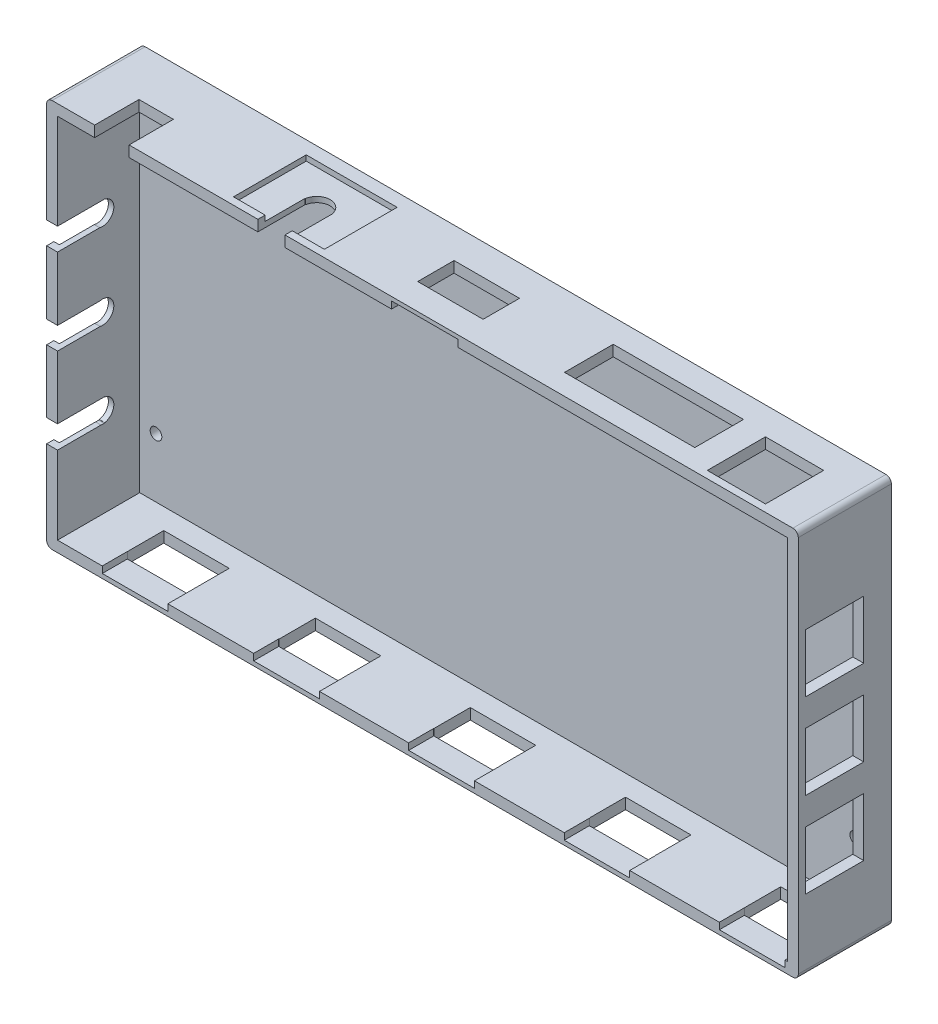
from build123d import *

# Parameters (mm, degrees)
SKETCH_1_W           = 206.744673609
SKETCH_1_H           = 106.97480061
EXTRUDE_1_DEPTH      = 3
SKETCH_3_W           = 200.744673609
SKETCH_3_H           = 100.97480061
EXTRUDE_2_DEPTH      = 22.6000508
SKETCH_4_W           = 18
SKETCH_4_H           = 10
CUT_EXTRUDE_1_DEPTH  = 5
SKETCH_6_W           = 16
SKETCH_6_H           = 16
CUT_EXTRUDE_2_DEPTH  = 5
SKETCH_7_W           = 16
SKETCH_7_H           = 16
CUT_EXTRUDE_3_DEPTH  = 5
SKETCH_8_W           = 18
SKETCH_8_H           = 10
CUT_EXTRUDE_4_DEPTH  = 5
SKETCH_9_W           = 35.828584262
SKETCH_9_H           = 13.394073463
CUT_EXTRUDE_5_DEPTH  = 5
SKETCH_10_R          = 3.719289999
CUT_EXTRUDE_6_DEPTH  = 5
SKETCH_11_W          = 9.469470229
SKETCH_11_H          = 12.194282659
CUT_EXTRUDE_7_DEPTH  = 5
SKETCH_12_R          = 3.134321658
CUT_EXTRUDE_8_DEPTH  = 5
SKETCH_13_R          = 1.6
CUT_EXTRUDE_9_DEPTH  = 5
SKETCH_15_W          = 25
SKETCH_15_H          = 20
CUT_EXTRUDE_11_DEPTH = 1.5
SKETCH_16_W          = 20
SKETCH_16_H          = 70
CUT_EXTRUDE_12_DEPTH = 1.5
FILLET_1_R           = 1.5
SKETCH_17_W          = 18.030255685
SKETCH_17_H          = 1.793339536
SKETCH_17_W_2        = 18.10659189
SKETCH_17_W_3        = 18.089855477
SKETCH_17_W_4        = 17.999756417
SKETCH_17_W_5        = 18.030454167
CUT_EXTRUDE_13_DEPTH = 6.89172601
SKETCH_18_W          = 18.338169952
SKETCH_18_H          = 1.939199609
CUT_EXTRUDE_14_DEPTH = 7.158781029
SKETCH_21_W          = 7.461807672
SKETCH_21_H          = 3.5
SKETCH_21_W_2        = 3.5
SKETCH_21_H_2        = 6.158755504
SKETCH_21_H_3        = 6.106655877
SKETCH_21_H_4        = 6.247919092
CUT_EXTRUDE_16_DEPTH = 13


with BuildPart() as part:
    # 草图1 → 凸台-拉伸1 (new body)
    with BuildSketch(Plane(origin=(0, 0, -6), x_dir=(-1, 0, 0), z_dir=(0, 0, -1))):
        with Locations((-142.557122174, -194.856389383)):
            Rectangle(SKETCH_1_W, SKETCH_1_H)
    extrude(amount=EXTRUDE_1_DEPTH)

    # 草图3 → 凸台-拉伸2 (add)
    with BuildSketch(Plane.XY.offset(-6)):
        Polygon((39.18478537, -141.368989078), (245.929458979, -141.368989078), (245.929458979, -248.343789688), (39.18478537, -248.343789688), (39.18478537, -243.18233024), (39.18478537, -146.483402372), align=None)
        with Locations((142.557122174, -194.856389383)):
            Rectangle(SKETCH_3_W, SKETCH_3_H, mode=Mode.SUBTRACT)
    extrude(amount=EXTRUDE_2_DEPTH)

    # 草图4 → 切除-拉伸1 (cut)
    with BuildSketch(Plane.XZ.offset(248.343789688)):
        with Locations((105.2106038, 4.708324791)):
            Rectangle(SKETCH_4_W, SKETCH_4_H)
        with Locations((63.5106038, 4.708324791)):
            Rectangle(SKETCH_4_W, SKETCH_4_H)
        with Locations((147.8106038, 4.708324791)):
            Rectangle(SKETCH_4_W, SKETCH_4_H)
        with Locations((190.5106038, 4.708324791)):
            Rectangle(SKETCH_4_W, SKETCH_4_H)
        with Locations((233.2106038, 4.708324791)):
            Rectangle(SKETCH_4_W, SKETCH_4_H)
    extrude(amount=-CUT_EXTRUDE_1_DEPTH, mode=Mode.SUBTRACT)

    # 草图6 → 切除-拉伸2 (cut)
    with BuildSketch(Plane(origin=(245.929458979, 0, 0), x_dir=(0, 0, -1), z_dir=(1, 0, 0))):
        with Locations((-6.6000508, -220.799301723)):
            Rectangle(SKETCH_6_W, SKETCH_6_H)
        with Locations((-6.6000508, -197.299301723)):
            Rectangle(SKETCH_6_W, SKETCH_6_H)
        with Locations((-6.6000508, -173.799301723)):
            Rectangle(SKETCH_6_W, SKETCH_6_H)
    extrude(amount=-CUT_EXTRUDE_2_DEPTH, mode=Mode.SUBTRACT)

    # 草图7 → 切除-拉伸3 (cut)
    with BuildSketch(Plane(origin=(0, -141.368989078, 0), x_dir=(1, 0, 0), z_dir=(0, 1, 0))):
        with Locations((226.905896319, -6.6000508)):
            Rectangle(SKETCH_7_W, SKETCH_7_H)
    extrude(amount=-CUT_EXTRUDE_3_DEPTH, mode=Mode.SUBTRACT)

    # 草图8 → 切除-拉伸4 (cut)
    with BuildSketch(Plane(origin=(0, -141.368989078, 0), x_dir=(1, 0, 0), z_dir=(0, 1, 0))):
        with Locations((143.087906607, -4.441269771)):
            Rectangle(SKETCH_8_W, SKETCH_8_H)
    extrude(amount=-CUT_EXTRUDE_4_DEPTH, mode=Mode.SUBTRACT)

    # 草图9 → 切除-拉伸5 (cut)
    with BuildSketch(Plane(origin=(0, -141.368989078, 0), x_dir=(1, 0, 0), z_dir=(0, 1, 0))):
        with Locations((193.834394064, -4.192873823)):
            Rectangle(SKETCH_9_W, SKETCH_9_H)
    extrude(amount=-CUT_EXTRUDE_5_DEPTH, mode=Mode.SUBTRACT)

    # 草图10 → 切除-拉伸6 (cut)
    with BuildSketch(Plane(origin=(0, -141.368989078, 0), x_dir=(1, 0, 0), z_dir=(0, 1, 0))):
        with Locations(Location((101.045841124, -4.188653157, 0), (0, 0, 270))):
            Circle(SKETCH_10_R)
    extrude(amount=-CUT_EXTRUDE_6_DEPTH, mode=Mode.SUBTRACT)

    # 草图11 → 切除-拉伸7 (cut)
    with BuildSketch(Plane(origin=(0, -141.368989078, 0), x_dir=(1, 0, 0), z_dir=(0, 1, 0))):
        with Locations((57.128440025, -10.502909471)):
            Rectangle(SKETCH_11_W, SKETCH_11_H)
    extrude(amount=-CUT_EXTRUDE_7_DEPTH, mode=Mode.SUBTRACT)

    # 草图12 → 切除-拉伸8 (cut)
    with BuildSketch(Plane.ZY.offset(-39.18478537)):
        with Locations((4.250612207, -173.693029578)):
            Circle(SKETCH_12_R)
        with Locations((4.250612207, -197.243029578)):
            Circle(SKETCH_12_R)
        with Locations((4.250612207, -220.793029578)):
            Circle(SKETCH_12_R)
    extrude(amount=-CUT_EXTRUDE_8_DEPTH, mode=Mode.SUBTRACT)

    # 草图13 → 切除-拉伸9 (cut)
    with BuildSketch(Plane(origin=(0, 0, -9), x_dir=(-1, 0, 0), z_dir=(0, 0, -1))):
        with Locations((-238.585543847, -149.289415757)):
            Circle(SKETCH_13_R)
        with Locations((-46.99814318, -148.85706783)):
            Circle(SKETCH_13_R)
        with Locations((-46.669564212, -229.041899724)):
            Circle(SKETCH_13_R)
        with Locations((-239.137231318, -229.121228359)):
            Circle(SKETCH_13_R)
    extrude(amount=-CUT_EXTRUDE_9_DEPTH, mode=Mode.SUBTRACT)

    # 草图15 → 切除-拉伸11 (cut)
    with BuildSketch(Plane(origin=(0, -141.368989078, 0), x_dir=(1, 0, 0), z_dir=(0, 1, 0))):
        with Locations((101.081540793, -4.6000508)):
            Rectangle(SKETCH_15_W, SKETCH_15_H)
    extrude(amount=-CUT_EXTRUDE_11_DEPTH, mode=Mode.SUBTRACT)

    # 草图16 → 切除-拉伸12 (cut)
    with BuildSketch(Plane.ZY.offset(-39.18478537)):
        with Locations((4.6000508, -197.704987162)):
            Rectangle(SKETCH_16_W, SKETCH_16_H)
    extrude(amount=-CUT_EXTRUDE_12_DEPTH, mode=Mode.SUBTRACT)

    # 圆角1
    fillet_1_edges = [part.edges().sort_by_distance(p)[0] for p in [
        (245.929458979, -141.368989078, 3.8000254),
        (39.18478537, -141.368989078, 3.8000254),
        (39.18478537, -248.343789688, 3.8000254),
        (245.929458979, -248.343789688, 3.8000254),
    ]]
    fillet(fillet_1_edges, radius=FILLET_1_R)

    # 草图17 → 切除-拉伸13 (cut)
    with BuildSketch(Plane.XY.offset(16.6000508)):
        with Locations((63.500922097, -246.240459456)):
            Rectangle(SKETCH_17_W, SKETCH_17_H)
        with Locations((105.179998956, -246.240459456)):
            Rectangle(SKETCH_17_W_2, SKETCH_17_H)
        with Locations((147.809231135, -246.240459456)):
            Rectangle(SKETCH_17_W_3, SKETCH_17_H)
        with Locations((190.556004567, -246.240459456)):
            Rectangle(SKETCH_17_W_4, SKETCH_17_H)
        with Locations((233.233676321, -246.240459456)):
            Rectangle(SKETCH_17_W_5, SKETCH_17_H)
    extrude(amount=-CUT_EXTRUDE_13_DEPTH, mode=Mode.SUBTRACT)

    # 草图18 → 切除-拉伸14 (cut)
    with BuildSketch(Plane.XY.offset(16.6000508)):
        with Locations((143.227232083, -143.399389273)):
            Rectangle(SKETCH_18_W, SKETCH_18_H)
    extrude(amount=-CUT_EXTRUDE_14_DEPTH, mode=Mode.SUBTRACT)

    # 草图21 → 切除-拉伸16 (cut)
    with BuildSketch(Plane.XY.offset(16.6000508)):
        with Locations((101.01663333, -143.118989078)):
            Rectangle(SKETCH_21_W, SKETCH_21_H)
        with Locations((40.93478537, -173.649755278)):
            Rectangle(SKETCH_21_W_2, SKETCH_21_H_2)
        with Locations((40.93478537, -197.254331907)):
            Rectangle(SKETCH_21_W_2, SKETCH_21_H_3)
        with Locations((40.93478537, -220.776300492)):
            Rectangle(SKETCH_21_W_2, SKETCH_21_H_4)
    extrude(amount=-CUT_EXTRUDE_16_DEPTH, mode=Mode.SUBTRACT)


solid = part.part
